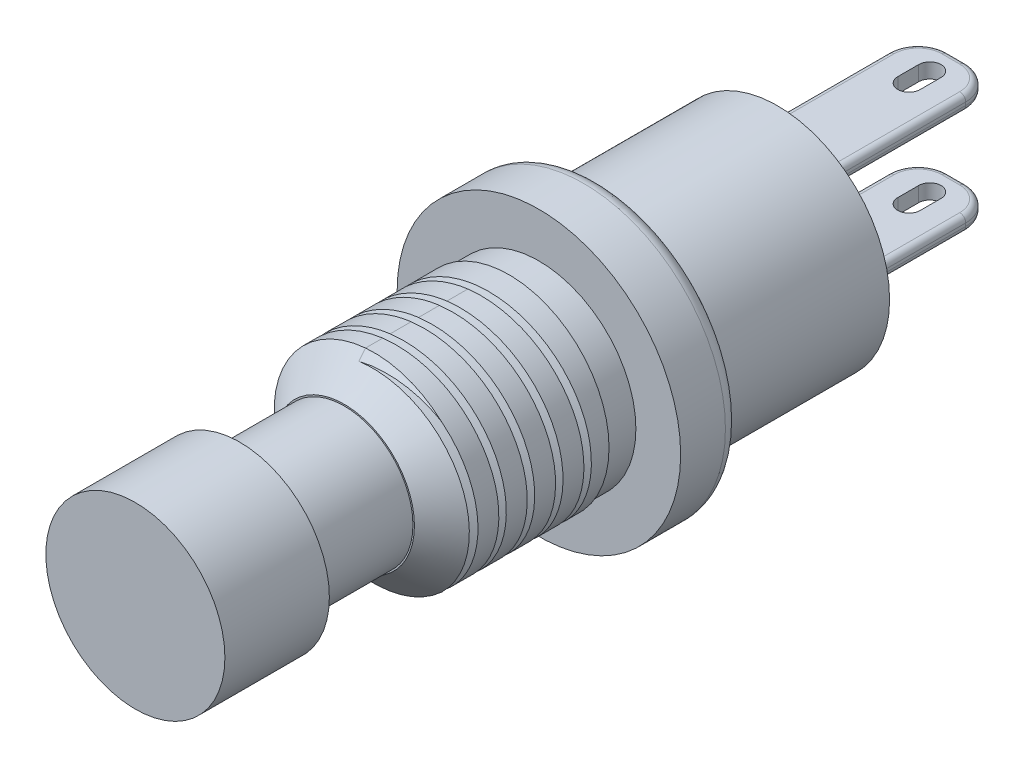
from build123d import *

# Parameters (mm, degrees)
SKETCH1_R           = 3.75
BOSS_EXTRUDE1_DEPTH = 6
SKETCH2_R           = 4.75
BOSS_EXTRUDE2_DEPTH = 2
FILLET1_R           = 0.5
SKETCH3_R           = 3.25
BOSS_EXTRUDE3_DEPTH = 1
SKETCH4_R           = 3.35
BOSS_EXTRUDE4_DEPTH = 5.52
CHAMFER1_SIZE       = 1
SKETCH5_R           = 2.3
BOSS_EXTRUDE5_DEPTH = 3.5
SKETCH6_R           = 3
BOSS_EXTRUDE6_DEPTH = 3.5
SKETCH7_W           = 2.6
SKETCH7_H           = 0.5
BOSS_EXTRUDE7_DEPTH = 6
FILLET4_R           = 1
CUT_EXTRUDE1_DEPTH  = 6
FILLET5_R           = 0.2
CUT_SWEEP1_PITCH    = 0.95
CUT_SWEEP1_HEIGHT   = 5.4625
CUT_SWEEP1_RADIUS   = 3.35


with BuildPart() as part:
    # Sketch1 → Boss-Extrude1 (new body)
    with BuildSketch(Plane.XY):
        Circle(SKETCH1_R)
    extrude(amount=BOSS_EXTRUDE1_DEPTH)

    # Sketch2 → Boss-Extrude2 (add)
    with BuildSketch(Plane.XY.offset(6)):
        Circle(SKETCH2_R)
    extrude(amount=BOSS_EXTRUDE2_DEPTH)

    # Fillet1
    fillet1_edges = [part.edges().sort_by_distance(p)[0] for p in [
        (-4.75, 0, 6),
    ]]
    fillet(fillet1_edges, radius=FILLET1_R)

    # Sketch3 → Boss-Extrude3 (add)
    with BuildSketch(Plane.XY.offset(8)):
        Circle(SKETCH3_R)
    extrude(amount=BOSS_EXTRUDE3_DEPTH)

    # Sketch4 → Boss-Extrude4 (add)
    with BuildSketch(Plane.XY.offset(9)):
        Circle(SKETCH4_R)
    extrude(amount=BOSS_EXTRUDE4_DEPTH)

    # Chamfer1
    chamfer1_edges = [part.edges().sort_by_distance(p)[0] for p in [
        (-3.35, 0, 14.52),
    ]]
    chamfer(chamfer1_edges, length=CHAMFER1_SIZE)

    # Sketch5 → Boss-Extrude5 (add)
    with BuildSketch(Plane.XY.offset(14.52)):
        Circle(SKETCH5_R)
    extrude(amount=BOSS_EXTRUDE5_DEPTH)

    # Sketch6 → Boss-Extrude6 (add)
    with BuildSketch(Plane.XY.offset(18.02)):
        Circle(SKETCH6_R)
    extrude(amount=BOSS_EXTRUDE6_DEPTH)

    # Sketch7 → Boss-Extrude7 (add)
    with BuildSketch(Plane(origin=(0, 0, 0), x_dir=(-1, 0, 0), z_dir=(0, 0, -1))):
        with Locations((0, 1.95926539)):
            Rectangle(SKETCH7_W, SKETCH7_H)
        with Locations((0, -1.550109141)):
            Rectangle(SKETCH7_W, SKETCH7_H)
    extrude(amount=BOSS_EXTRUDE7_DEPTH)

    # Fillet4
    fillet4_edges = [part.edges().sort_by_distance(p)[0] for p in [
        (-1.3, 1.95926539, -6),
        (1.3, 1.95926539, -6),
        (-1.3, -1.550109141, -6),
        (1.3, -1.550109141, -6),
    ]]
    fillet(fillet4_edges, radius=FILLET4_R)

    # Sketch8 → Cut-Extrude1 (cut)
    with BuildSketch(Plane.XZ.offset(1.800109141)):
        with BuildLine():
            Line((0.375, -4.4), (0.375, -5.1))
            ThreePointArc((0.375, -5.1), (0, -5.475), (-0.375, -5.1))
            Line((-0.375, -5.1), (-0.375, -4.4))
            ThreePointArc((-0.375, -4.4), (0, -4.025), (0.375, -4.4))
        make_face()
    extrude(amount=-CUT_EXTRUDE1_DEPTH, mode=Mode.SUBTRACT)

    # Fillet5
    fillet5_edges = [part.edges().sort_by_distance(p)[0] for p in [
        (0, 2.20926539, -6),
        (0, 1.70926539, -6),
        (-1.3, 1.70926539, -2.5),
        (1.3, 1.70926539, -2.5),
        (-1.007106781, 1.70926539, -5.707106781),
        (1.007106781, 1.70926539, -5.707106781),
        (1.3, 2.20926539, -2.5),
        (-1.3, 2.20926539, -2.5),
        (-1.007106781, 2.20926539, -5.707106781),
        (1.007106781, 2.20926539, -5.707106781),
        (0, -1.300109141, -6),
        (0, -1.800109141, -6),
        (1.3, -1.300109141, -2.5),
        (-1.3, -1.300109141, -2.5),
        (1.007106781, -1.300109141, -5.707106781),
        (-1.007106781, -1.300109141, -5.707106781),
        (-1.3, -1.800109141, -2.5),
        (1.3, -1.800109141, -2.5),
        (1.007106781, -1.800109141, -5.707106781),
        (-1.007106781, -1.800109141, -5.707106781),
    ]]
    fillet(fillet5_edges, radius=FILLET5_R)

    # Cut-Sweep1: sweep along a helix
    with BuildLine() as cut_sweep1_path:
        Helix(CUT_SWEEP1_PITCH, CUT_SWEEP1_HEIGHT, CUT_SWEEP1_RADIUS, center=(0, 0, 14.52), direction=(0, 0, -1))
    # Sketch9 → Cut-Sweep1 (sweep, cut)
    with BuildSketch(Plane(origin=(0, 0, 0), x_dir=(1, 0, 0), z_dir=(0, 1, 0))):
        Polygon((3.1, -13.52), (4.1, -13.02), (4.1, -14.02), align=None)
    sweep(path=cut_sweep1_path.line, is_frenet=True, mode=Mode.SUBTRACT)


solid = part.part
